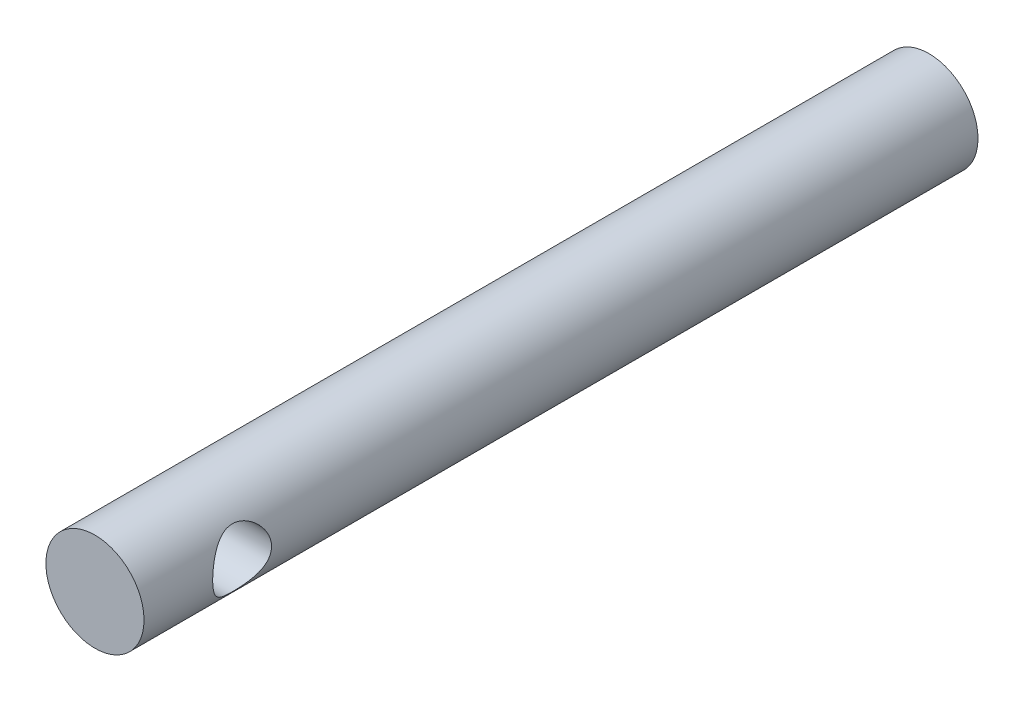
from build123d import *

# Parameters (mm, degrees)
CROQUIS1_R              = 2.5
SALIENTE_EXTRUIR1_DEPTH = 42.5
CROQUIS2_R              = 1.5
CORTAR_EXTRUIR1_DEPTH   = 25


with BuildPart() as part:
    # Croquis1 → Saliente-Extruir1 (new body)
    with BuildSketch(Plane.XY):
        Circle(CROQUIS1_R)
    extrude(amount=SALIENTE_EXTRUIR1_DEPTH)

    # Croquis2 → Cortar-Extruir1 (cut, symmetric)
    with BuildSketch(Plane(origin=(0, 0, 0), x_dir=(0, 0, -1), z_dir=(1, 0, 0))):
        with Locations(Location((-37.5, 0, 0), (0, 0, 179.999999998))):
            Circle(CROQUIS2_R)
    extrude(amount=CORTAR_EXTRUIR1_DEPTH, both=True, mode=Mode.SUBTRACT)


solid = part.part
